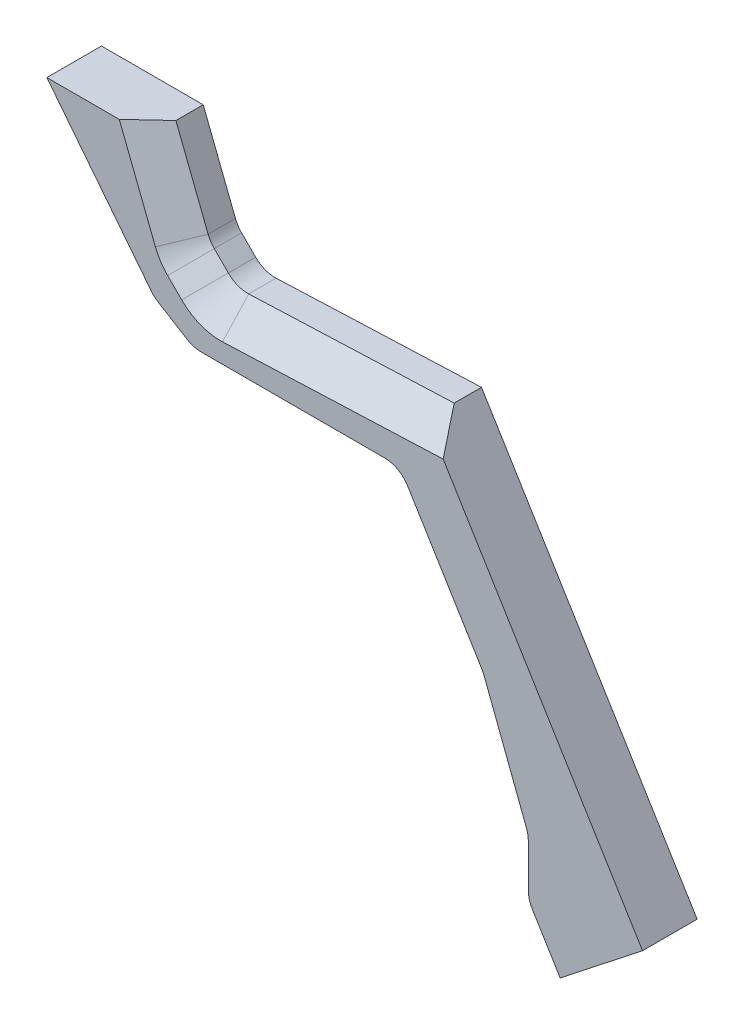
from build123d import *

# Parameters (mm, degrees)
BOSS_EXTRUDE1_DEPTH      = 6.35
BOSS_EXTRUDE1_DEPTH_BACK = 6.35
CHAMFER1_SIZE            = 6.35


with BuildPart() as part:
    # Sketch1 → Boss-Extrude1 (new, two sides: drawn at the far end of the back side and taken through both)
    with BuildSketch(Plane.XY.offset(-BOSS_EXTRUDE1_DEPTH_BACK)):
        with BuildLine():
            Line((536.695979739, 136.254867707), (560.943105898, 105.436216324))
            ThreePointArc((560.943105898, 105.436216324), (561.714171823, 104.617286319), (562.617631945, 103.947249887))
            Line((562.617631945, 103.947249887), (569.277605982, 99.869101199))
            ThreePointArc((569.277605982, 99.869101199), (570.871029516, 99.172603505), (572.593645863, 98.934484797))
            Line((572.593645863, 98.934484797), (615.194822187, 98.934484797))
            ThreePointArc((615.194822187, 98.934484797), (618.300590104, 98.123140378), (620.612705276, 95.896439332))
            Line((620.612705276, 95.896439332), (637.800986726, 67.778873585))
            ThreePointArc((637.800986726, 67.778873585), (638.081311904, 67.269225698), (638.313826657, 66.736065249))
            Line((638.313826657, 66.736065249), (648.207776972, 40.876876924))
            ThreePointArc((648.207776972, 40.876876924), (648.521355002, 39.761509046), (648.627053953, 38.607730725))
            Line((648.627053953, 38.607730725), (648.627053953, 28.543161139))
            ThreePointArc((648.627053953, 28.543161139), (648.864523478, 26.822849773), (649.559170865, 25.231206604))
            Line((649.559170865, 25.231206604), (652.382425554, 20.612766444))
            Line((652.382425554, 20.612766444), (656.038853698, 14.631373886))
            Line((656.038853698, 14.631373886), (675.181083361, 29.691866048))
            Line((675.181083361, 29.691866048), (625.044285009, 111.708484642))
            Line((625.044285009, 111.708484642), (577.280315143, 109.804848162))
            ThreePointArc((577.280315143, 109.804848162), (574.71471638, 110.235943554), (572.537308132, 111.659682846))
            Line((572.537308132, 111.659682846), (569.268870721, 114.928120257))
            ThreePointArc((569.268870721, 114.928120257), (568.444852538, 115.94228087), (567.845871294, 117.103637483))
            Line((567.845871294, 117.103637483), (560.349390782, 136.254867707))
            Line((560.349390782, 136.254867707), (536.695979739, 136.254867707))
        make_face()
    extrude(amount=BOSS_EXTRUDE1_DEPTH + BOSS_EXTRUDE1_DEPTH_BACK)

    # Chamfer1
    chamfer1_edges = [part.edges().sort_by_distance(p)[0] for p in [
        (564.097631038, 126.679252595, 6.35),
        (568.444852538, 115.94228087, 6.35),
        (570.903089427, 113.293901552, 6.35),
        (574.71471638, 110.235943554, 6.35),
        (601.162300076, 110.756666402, 6.35),
    ]]
    chamfer(chamfer1_edges, length=CHAMFER1_SIZE)


solid = part.part
